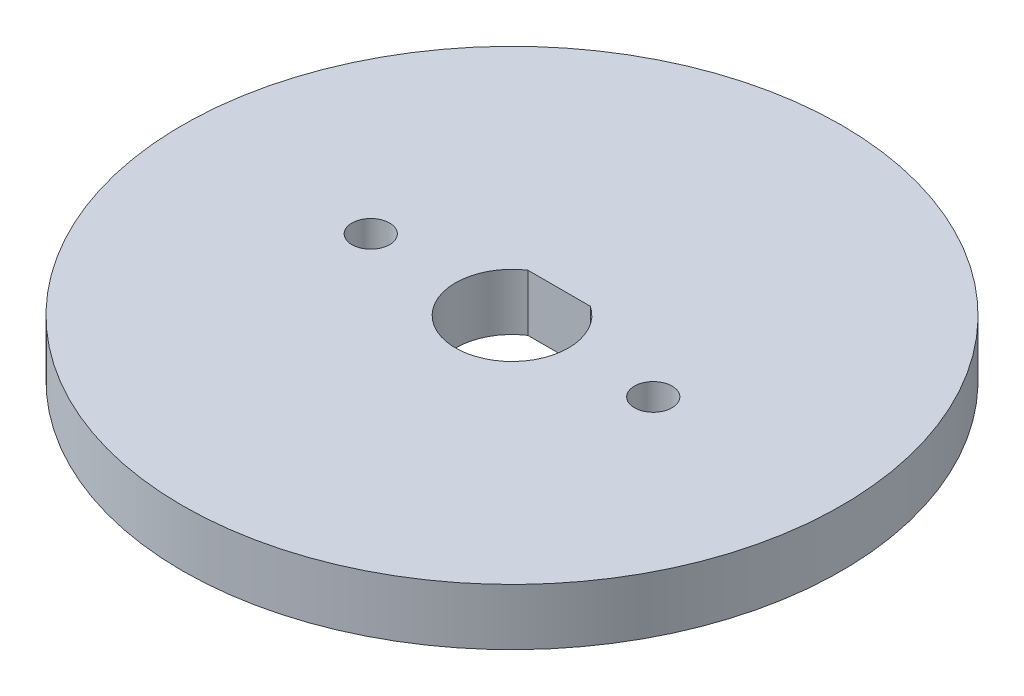
from build123d import *

# Parameters (mm, degrees)
SKIZZE1_R                       = 17.5
AUFSATZ_LINEAR_AUSTRAGEN1_DEPTH = 3
SKIZZE2_R                       = 1
SCHNITT_LINEAR_AUSTRAGEN1_DEPTH = 25.929901725


with BuildPart() as part:
    # Skizze1 → Aufsatz-Linear austragen1 (new body)
    with BuildSketch(Plane(origin=(0, 0, 0), x_dir=(1, 0, 0), z_dir=(0, 1, 0))):
        with Locations(Location((0, 0, 0), (0, 0, 270))):
            Circle(SKIZZE1_R)
    extrude(amount=AUFSATZ_LINEAR_AUSTRAGEN1_DEPTH)

    # Skizze2 → Schnitt-Linear austragen1 (cut, through all)
    with BuildSketch(Plane(origin=(0, 3, 0), x_dir=(1, 0, 0), z_dir=(0, 1, 0))):
        with Locations(Location((-7.5, 0, 0), (0, 0, 270))):
            Circle(SKIZZE2_R)
        with Locations(Location((7.5, 0, 0), (0, 0, 270))):
            Circle(SKIZZE2_R)
        with BuildLine():
            Line((-1.658312395, 2.5), (1.658312395, 2.5))
            ThreePointArc((1.658312395, 2.5), (0, -3), (-1.658312395, 2.5))
        make_face()
    extrude(amount=-SCHNITT_LINEAR_AUSTRAGEN1_DEPTH, mode=Mode.SUBTRACT)


solid = part.part
